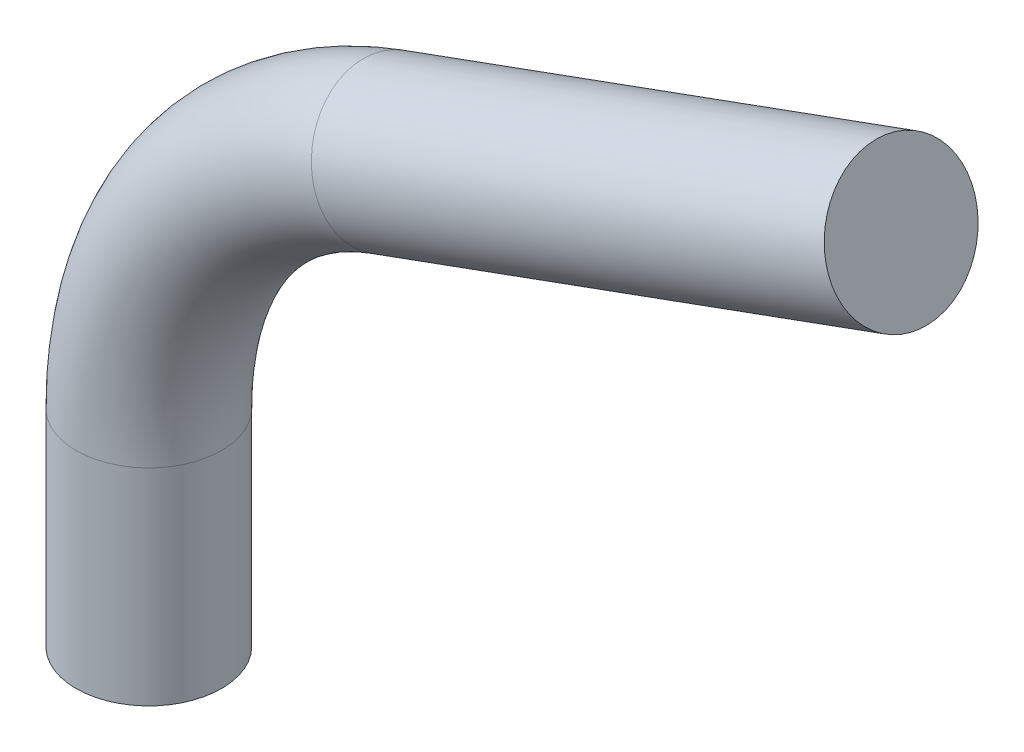
from build123d import *

# Parameters (mm, degrees)
SKETCH2_R = 3


with BuildPart() as part:
    # Sweep1: sweep along a path in Sketch1
    with BuildLine(Plane.XY) as sweep1_path:
        Line((0, 0), (0, 8.496886927))
        ThreePointArc((0, 8.496886927), (2.712719336, 17.100533472), (9.86969785, 22.592276239))
        Line((9.86969785, 22.592276239), (31.009856486, 30.28666473))
    # Sketch2 → Sweep1 (sweep)
    with BuildSketch(Plane(origin=(0, 0, 0), x_dir=(1, 0, 0), z_dir=(0, 1, 0))):
        Circle(SKETCH2_R)
    sweep(path=sweep1_path.line)


solid = part.part
